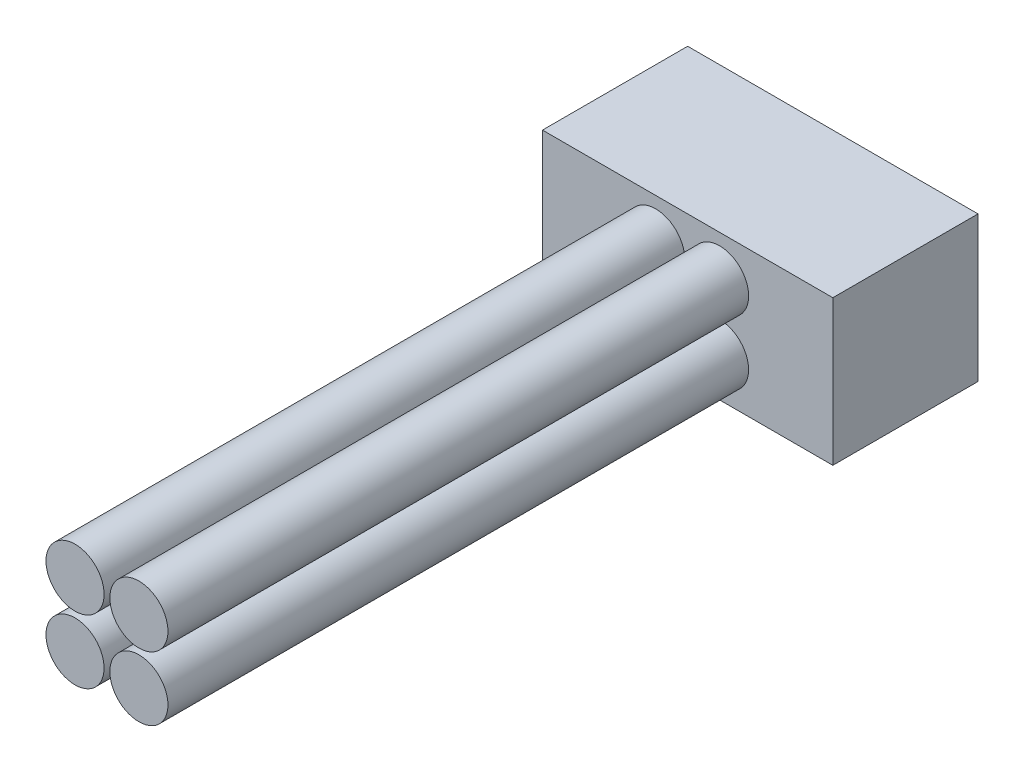
from build123d import *

# Parameters (mm, degrees)
SKETCH1_W           = 10
SKETCH1_H           = 5
BOSS_EXTRUDE1_DEPTH = 5
SKETCH2_R           = 1
BOSS_EXTRUDE2_DEPTH = 20


with BuildPart() as part:
    # Sketch1 → Boss-Extrude1 (new body)
    with BuildSketch(Plane.XY):
        with Locations((5, 2.5)):
            Rectangle(SKETCH1_W, SKETCH1_H)
    extrude(amount=BOSS_EXTRUDE1_DEPTH)

    # Sketch2 → Boss-Extrude2 (add)
    with BuildSketch(Plane.XY.offset(5)):
        with Locations(Location((3.9, 3.6, 0), (0, 0, 180))):
            Circle(SKETCH2_R)
        with Locations(Location((6.1, 3.6, 0), (0, 0, 180))):
            Circle(SKETCH2_R)
        with Locations(Location((3.9, 1.4, 0), (0, 0, 180))):
            Circle(SKETCH2_R)
        with Locations(Location((6.1, 1.4, 0), (0, 0, 180))):
            Circle(SKETCH2_R)
    extrude(amount=BOSS_EXTRUDE2_DEPTH)


solid = part.part
